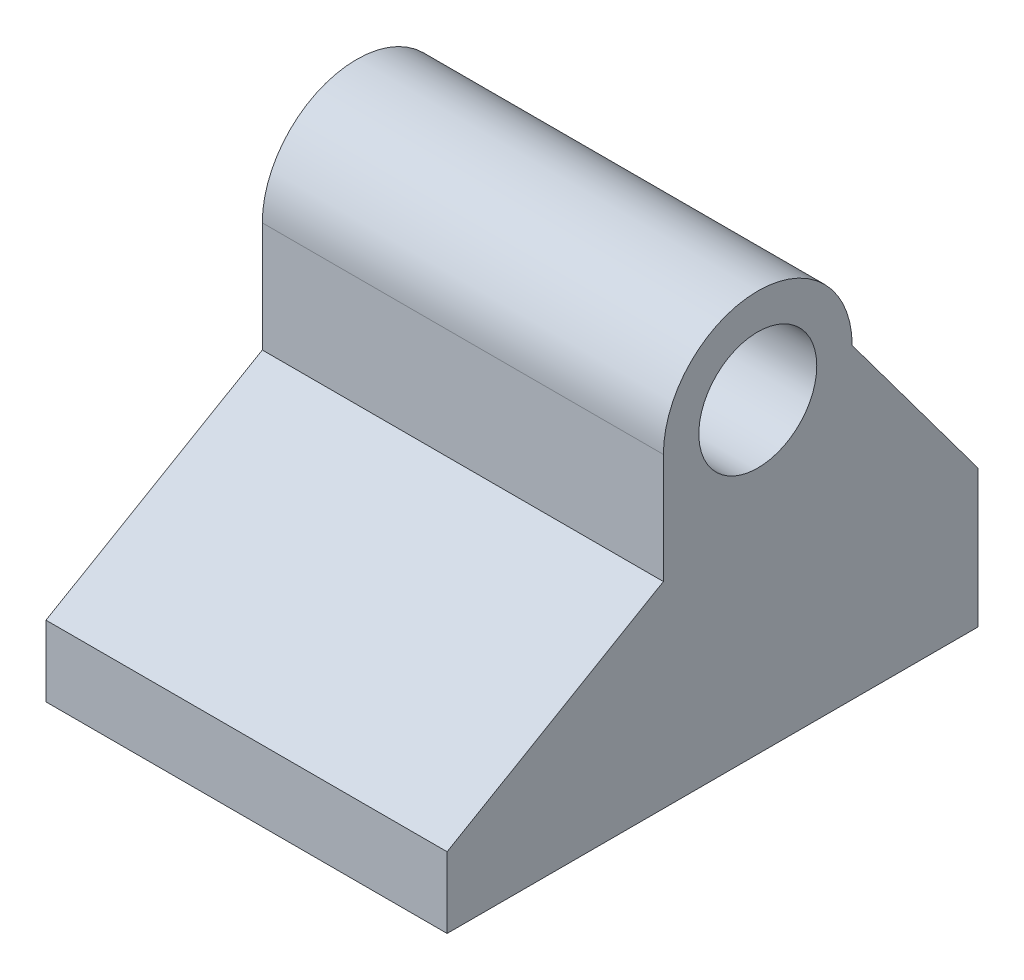
from build123d import *

# Parameters (mm, degrees)
EXTRUDE_START   = 0.633192
SKETCH_1_R      = 15
EXTRUDE_3_DEPTH = 102


with BuildPart() as part:
    # Эскиз1 → Бобышка-Вытянуть3 (new body)
    with BuildSketch(Plane(origin=(0, 0, 0), x_dir=(0, 0, -1), z_dir=(1, 0, 0)).offset(EXTRUDE_START)):
        with BuildLine():
            Line((0, 0), (0, 35))
            Line((0, 35), (-32, 78))
            ThreePointArc((-32, 78), (-56, 102), (-80, 78))
            Line((-80, 78), (-80, 50))
            Line((-80, 50), (-135, 18))
            Line((-135, 18), (-135, 0))
            Line((-135, 0), (0, 0))
        make_face()
        with Locations((-56, 78)):
            Circle(SKETCH_1_R, mode=Mode.SUBTRACT)
    extrude(amount=EXTRUDE_3_DEPTH)


solid = part.part
